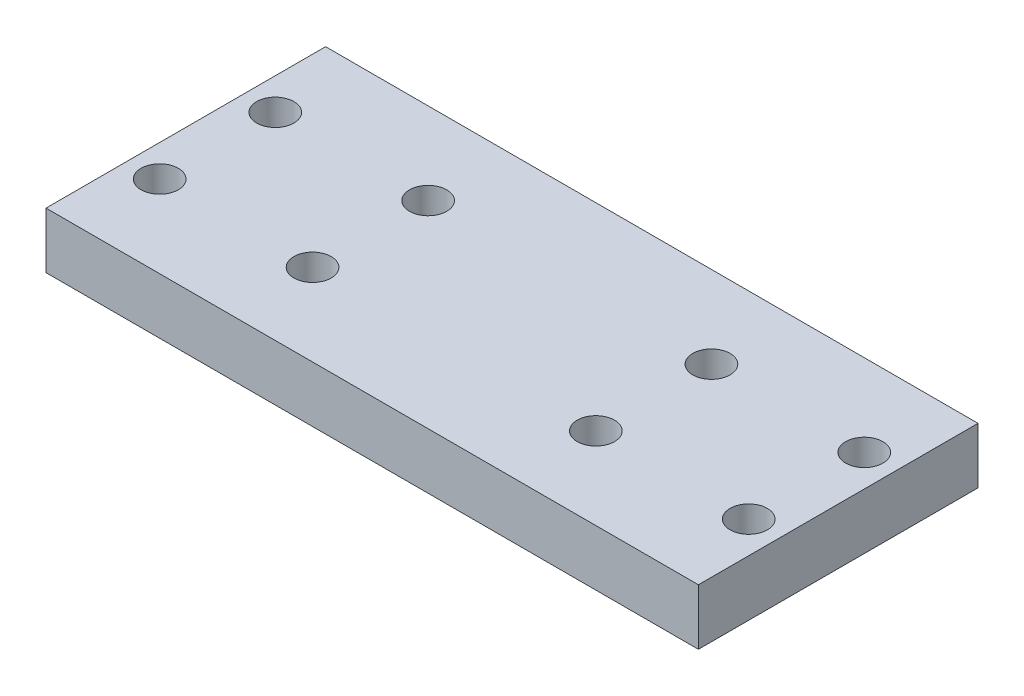
from build123d import *

# Parameters (mm, degrees)
SKETCH1_W           = 350
SKETCH1_H           = 150
SKETCH1_R           = 10
BOSS_EXTRUDE1_DEPTH = 30


with BuildPart() as part:
    # Sketch1 → Boss-Extrude1 (new body)
    with BuildSketch(Plane(origin=(0, 0, 0), x_dir=(1, 0, 0), z_dir=(0, 1, 0))):
        with Locations((-60, 0)):
            Rectangle(SKETCH1_W, SKETCH1_H)
        with Locations(Location((-218, 31, 0), (0, 0, 270))):
            Circle(SKETCH1_R, mode=Mode.SUBTRACT)
        with Locations(Location((-136, 31, 0), (0, 0, 270))):
            Circle(SKETCH1_R, mode=Mode.SUBTRACT)
        with Locations(Location((-136, -31, 0), (0, 0, 270))):
            Circle(SKETCH1_R, mode=Mode.SUBTRACT)
        with Locations(Location((-218, -31, 0), (0, 0, 270))):
            Circle(SKETCH1_R, mode=Mode.SUBTRACT)
        with Locations(Location((16, -31, 0), (0, 0, 90))):
            Circle(SKETCH1_R, mode=Mode.SUBTRACT)
        with Locations(Location((16, 31, 0), (0, 0, 90))):
            Circle(SKETCH1_R, mode=Mode.SUBTRACT)
        with Locations(Location((98, 31, 0), (0, 0, 90))):
            Circle(SKETCH1_R, mode=Mode.SUBTRACT)
        with Locations(Location((98, -31, 0), (0, 0, 90))):
            Circle(SKETCH1_R, mode=Mode.SUBTRACT)
    extrude(amount=BOSS_EXTRUDE1_DEPTH)


solid = part.part
